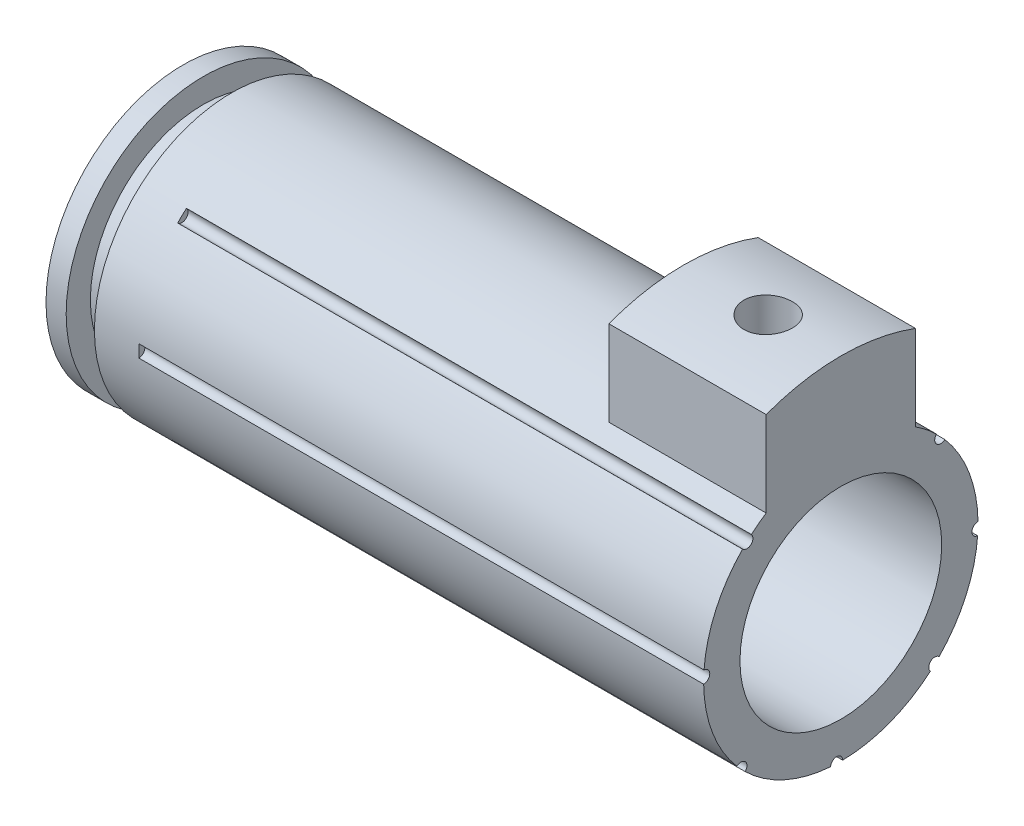
from build123d import *

# Parameters (mm, degrees)
BOSS_EXTRUDE1_DEPTH = 13.462
SKETCH7_OUTSIDE_W   = 29.274
SKETCH7_OUTSIDE_H   = 34.1
SKETCH7_OUTSIDE_R   = 13.462
CUT_EXTRUDE1_DEPTH  = 13.462
SKETCH8_R           = 1.524
CUT_EXTRUDE2_DEPTH  = 6.35
SKETCH9_R           = 6.35
CUT_EXTRUDE3_DEPTH  = 45.383910909
SKETCH10_R          = 0.381
CUT_EXTRUDE4_DEPTH  = 35.56
CIRPATTERN1_COUNT   = 8


with BuildPart() as part:
    # Sketch1 → Revolve1 (revolve)
    with BuildSketch(Plane.XY, mode=Mode.PRIVATE) as revolve1_sk:
        Polygon((20.701, 0), (20.701, 8.636), (-17.653, 8.636), (-17.653, 7.112), (-19.431, 7.112), (-19.431, 8.636), (-20.701, 8.636), (-20.701, 0), align=None)
    revolve(revolve1_sk.sketch.rotate(Axis((-78.241804248, 0, 0), (1, 0, 0)), 90), axis=Axis((-78.241804248, 0, 0), (1, 0, 0)))

    # Sketch6 → Boss-Extrude1 (add)
    with BuildSketch(Plane(origin=(0, 0, 0), x_dir=(1, 0, 0), z_dir=(0, 1, 0))):
        Polygon((20.701, 0), (20.701, 4.699), (10.795, 4.699), (10.795, -4.699), (20.701, -4.699), align=None)
    extrude(amount=BOSS_EXTRUDE1_DEPTH)

    # Sketch7 outside → Cut-Extrude1 (cut)
    with BuildSketch(Plane(origin=(20.701, 0, 0), x_dir=(0, 0, -1), z_dir=(1, 0, 0))):
        with Locations((0, 2.413)):
            Rectangle(SKETCH7_OUTSIDE_W, SKETCH7_OUTSIDE_H)
        Circle(SKETCH7_OUTSIDE_R, mode=Mode.SUBTRACT)
    extrude(amount=-CUT_EXTRUDE1_DEPTH, mode=Mode.SUBTRACT)

    # Sketch8 → Cut-Extrude2 (cut)
    with BuildSketch(Plane(origin=(0, 13.462, 0), x_dir=(-1, 0, 0), z_dir=(0, 1, 0))):
        with Locations(Location((-16.129, 0, 0), (0, 0, 90))):
            Circle(SKETCH8_R)
    extrude(amount=-CUT_EXTRUDE2_DEPTH, mode=Mode.SUBTRACT)

    # Sketch9 → Cut-Extrude3 (cut, through all)
    with BuildSketch(Plane(origin=(20.701, 0, 0), x_dir=(0, 0, -1), z_dir=(1, 0, 0))):
        Circle(SKETCH9_R)
    extrude(amount=-CUT_EXTRUDE3_DEPTH, mode=Mode.SUBTRACT)

    # Sketch10 → Cut-Extrude4 (cut)
    with BuildSketch(Plane(origin=(20.701, 0, 0), x_dir=(0, 0, -1), z_dir=(1, 0, 0))):
        with Locations((-5.916324211, 6.291073345)):
            Circle(SKETCH10_R)
    cut_extrude4 = extrude(amount=-CUT_EXTRUDE4_DEPTH, mode=Mode.SUBTRACT)

    # CirPattern1: Cut-Extrude4 ×8 about axis, 1 skipped
    cirpattern1_axis = Axis((20.701, 0, 0), (-1, 0, 0))
    add([cut_extrude4.rotate(cirpattern1_axis, i * 360 / CIRPATTERN1_COUNT) for i in range(1, CIRPATTERN1_COUNT) if i not in (1,)], mode=Mode.SUBTRACT)


solid = part.part
